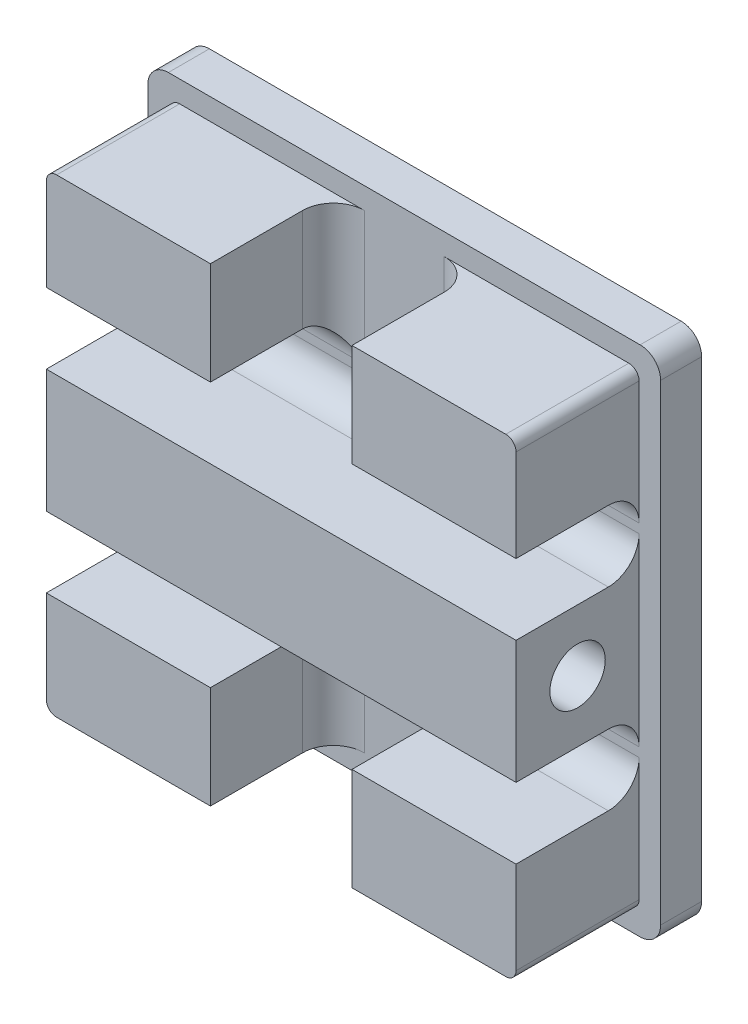
from build123d import *

# Parameters (mm, degrees)
SKETCH_1_W          = 25
SKETCH_1_H          = 25
EXTRUDE_1_DEPTH     = 2
SKETCH_2_W          = 22.9
SKETCH_2_H          = 22.9
EXTRUDE_2_DEPTH     = 6
FILLET_1_R          = 1
CUT_EXTRUDE_3_DEPTH = 0.6
FILLET_2_R          = 0.5
FILLET_3_R          = 0.1
SKETCH_7_R          = 1.35
CUT_EXTRUDE_4_DEPTH = 29.175388325
CUT_EXTRUDE_5_DEPTH = 6
FILLET_4_R          = 1.5


with BuildPart() as part:
    # 草图1 → 凸台-拉伸1 (new body)
    with BuildSketch(Plane.XY):
        Rectangle(SKETCH_1_W, SKETCH_1_H)
    extrude(amount=EXTRUDE_1_DEPTH)

    # 草图2 → 凸台-拉伸2 (add)
    with BuildSketch(Plane.XY.offset(2)):
        Rectangle(SKETCH_2_W, SKETCH_2_H)
    extrude(amount=EXTRUDE_2_DEPTH)

    # 圆角1
    fillet_1_edges = [part.edges().sort_by_distance(p)[0] for p in [
        (-12.5, 12.5, 1),
        (12.5, 12.5, 1),
        (12.5, -12.5, 1),
        (-12.5, -12.5, 1),
    ]]
    fillet(fillet_1_edges, radius=FILLET_1_R)

    # 草图6 → 切除-拉伸3 (cut)
    with BuildSketch(Plane(origin=(0, 0, 0), x_dir=(-1, 0, 0), z_dir=(0, 0, -1))):
        with BuildLine():
            Line((-7.681980515, -0.681980515), (0, -8.363961031))
            Line((0, -8.363961031), (7.681980515, -0.681980515))
            ThreePointArc((7.681980515, -0.681980515), (6.222075446, 6.657457896), (0, 2.5))
            ThreePointArc((0, 2.5), (-6.222075446, 6.657457896), (-7.681980515, -0.681980515))
        make_face()
    extrude(amount=-CUT_EXTRUDE_3_DEPTH, mode=Mode.SUBTRACT)

    # 圆角2
    fillet_2_edges = [part.edges().sort_by_distance(p)[0] for p in [
        (11.45, -11.45, 5),
        (11.45, 11.45, 5),
        (-11.45, 11.45, 5),
        (-11.45, -11.45, 5),
    ]]
    fillet(fillet_2_edges, radius=FILLET_2_R)

    # 圆角3
    fillet_3_edges = [part.edges().sort_by_distance(p)[0] for p in [
        (0, 2.5, 0.3),
    ]]
    fillet(fillet_3_edges, radius=FILLET_3_R)

    # 草图7 → 切除-拉伸4 (cut, through all)
    with BuildSketch(Plane(origin=(11.45, 0, 0), x_dir=(0, 0, -1), z_dir=(1, 0, 0))):
        with Locations((-5, 0)):
            Circle(SKETCH_7_R)
    extrude(amount=-CUT_EXTRUDE_4_DEPTH, mode=Mode.SUBTRACT)

    # 草图8 → 切除-拉伸5 (cut)
    with BuildSketch(Plane.XY.offset(8)):
        Polygon((-11.45, 3), (11.45, 3), (11.45, 6.45), (3.45, 6.45), (3.45, 11.45), (-3.45, 11.45), (-3.45, 6.45), (-11.45, 6.45), align=None)
        Polygon((-11.45, -6.45), (-3.45, -6.45), (-3.45, -11.45), (3.45, -11.45), (3.45, -6.45), (11.45, -6.45), (11.45, -3), (-11.45, -3), align=None)
    extrude(amount=-CUT_EXTRUDE_5_DEPTH, mode=Mode.SUBTRACT)

    # 圆角4
    fillet_4_edges = [part.edges().sort_by_distance(p)[0] for p in [
        (7.45, 6.45, 2),
        (0, 3, 2),
        (-7.45, 6.45, 2),
        (-3.45, 8.95, 2),
        (3.45, 8.95, 2),
        (0, -3, 2),
        (7.45, -6.45, 2),
        (3.45, -8.95, 2),
        (-3.45, -8.95, 2),
        (-7.45, -6.45, 2),
    ]]
    fillet(fillet_4_edges, radius=FILLET_4_R)


solid = part.part
